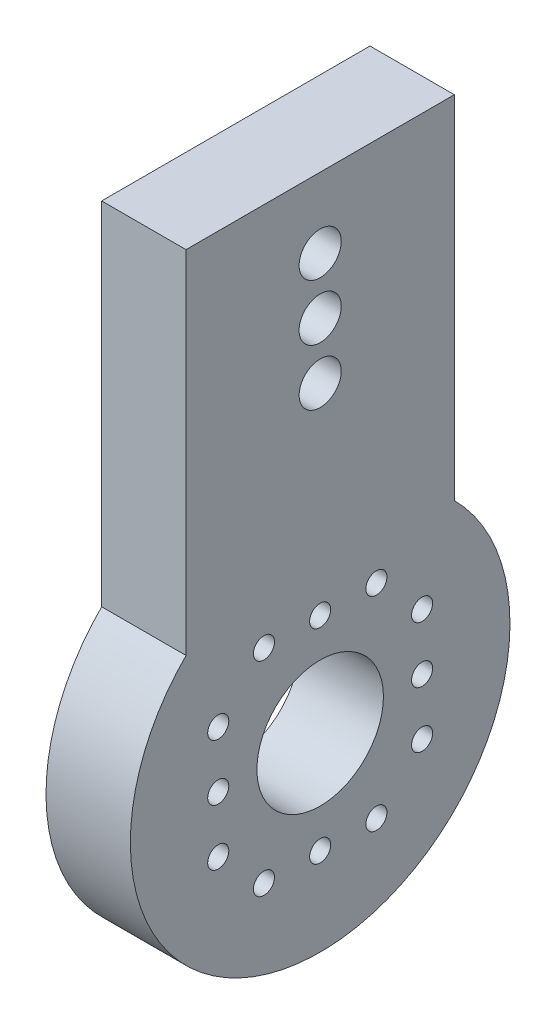
from build123d import *

# Parameters (mm, degrees)
SKETCH1_R           = 4.5
SKETCH1_R_2         = 0.75
SKETCH1_R_3         = 1.5
SKETCH1_R_4         = 1.498254454
BOSS_EXTRUDE1_DEPTH = 6


with BuildPart() as part:
    # Sketch1 → Boss-Extrude1 (new body)
    with BuildSketch(Plane(origin=(0, 0, 0), x_dir=(0, 0, -1), z_dir=(1, 0, 0))):
        with BuildLine():
            Line((-9.542574057, 9.549307848), (-9.542574057, 34.549307848))
            Line((-9.542574057, 34.549307848), (9.542574057, 34.549307848))
            Line((9.542574057, 34.549307848), (9.542574057, 9.549307848))
            ThreePointArc((9.542574057, 9.549307848), (0, -13.5), (-9.542574057, 9.549307848))
        make_face()
        Circle(SKETCH1_R, mode=Mode.SUBTRACT)
        with Locations((0, 7.25)):
            Circle(SKETCH1_R_2, mode=Mode.SUBTRACT)
        with Locations((4, 7.25)):
            Circle(SKETCH1_R_2, mode=Mode.SUBTRACT)
        with Locations((-4, 7.25)):
            Circle(SKETCH1_R_2, mode=Mode.SUBTRACT)
        with Locations(Location((4, -7.25, 0), (0, 0, 180))):
            Circle(SKETCH1_R_2, mode=Mode.SUBTRACT)
        with Locations(Location((0, -7.25, 0), (0, 0, 180))):
            Circle(SKETCH1_R_2, mode=Mode.SUBTRACT)
        with Locations(Location((-4, -7.25, 0), (0, 0, 180))):
            Circle(SKETCH1_R_2, mode=Mode.SUBTRACT)
        with Locations((7.25, -4)):
            Circle(SKETCH1_R_2, mode=Mode.SUBTRACT)
        with Locations((7.25, 0)):
            Circle(SKETCH1_R_2, mode=Mode.SUBTRACT)
        with Locations((7.25, 4)):
            Circle(SKETCH1_R_2, mode=Mode.SUBTRACT)
        with Locations((-7.25, 4)):
            Circle(SKETCH1_R_2, mode=Mode.SUBTRACT)
        with Locations((-7.25, 0)):
            Circle(SKETCH1_R_2, mode=Mode.SUBTRACT)
        with Locations((-7.25, -4)):
            Circle(SKETCH1_R_2, mode=Mode.SUBTRACT)
        with Locations((0, 29.549307848)):
            Circle(SKETCH1_R_3, mode=Mode.SUBTRACT)
        with Locations((0, 25.549307848)):
            Circle(SKETCH1_R_3, mode=Mode.SUBTRACT)
        with Locations((0, 21.549307848)):
            Circle(SKETCH1_R_4, mode=Mode.SUBTRACT)
    extrude(amount=BOSS_EXTRUDE1_DEPTH)


solid = part.part
